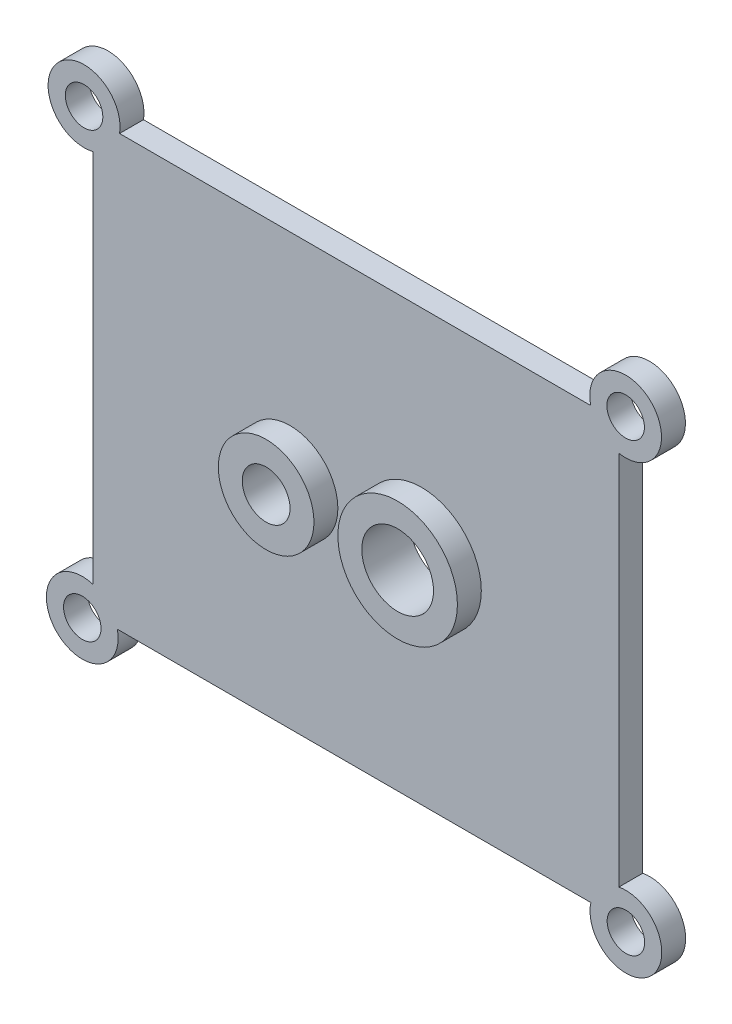
from build123d import *

# Parameters (mm, degrees)
SKETCH1_W           = 69.85
SKETCH1_H           = 57.15
BOSS_EXTRUDE1_DEPTH = 3.175
SKETCH2_R           = 4.776740808
SKETCH2_R_2         = 4.7625
BOSS_EXTRUDE2_DEPTH = 3.175
SKETCH3_R           = 2.4892
CUT_EXTRUDE1_DEPTH  = 54.678109207
SKETCH4_R           = 3.175
SKETCH4_R_2         = 4.7625
CUT_EXTRUDE2_DEPTH  = 54.678109207
SKETCH5_R           = 6.35
SKETCH5_R_2         = 7.9375
BOSS_EXTRUDE3_DEPTH = 3.175
SKETCH6_R           = 4.7625
SKETCH6_R_2         = 3.175
CUT_EXTRUDE3_DEPTH  = 54.959070443


with BuildPart() as part:
    # Sketch1 → Boss-Extrude1 (new body)
    with BuildSketch(Plane.XY):
        Rectangle(SKETCH1_W, SKETCH1_H)
    extrude(amount=BOSS_EXTRUDE1_DEPTH)

    # Sketch2 → Boss-Extrude2 (add)
    with BuildSketch(Plane.XY.offset(3.175)):
        with Locations((-36.080944449, 29.359475258)):
            Circle(SKETCH2_R)
        with Locations((35.832665303, 29.636957013)):
            Circle(SKETCH2_R_2)
        with Locations((35.864779118, -29.608646076)):
            Circle(SKETCH2_R_2)
        with Locations((-36.322, -29.590559194)):
            Circle(SKETCH2_R_2)
    extrude(amount=-BOSS_EXTRUDE2_DEPTH)

    # Sketch3 → Cut-Extrude1 (cut, through all)
    with BuildSketch(Plane.XY.offset(3.175)):
        with Locations((-36.080944449, 29.359475258)):
            Circle(SKETCH3_R)
        with Locations((35.832665303, 29.636957013)):
            Circle(SKETCH3_R)
        with Locations((35.864779118, -29.608646076)):
            Circle(SKETCH3_R)
        with Locations((-36.322, -29.590559194)):
            Circle(SKETCH3_R)
    extrude(amount=-CUT_EXTRUDE1_DEPTH, mode=Mode.SUBTRACT)

    # Sketch4 → Cut-Extrude2 (cut, through all)
    with BuildSketch(Plane.XY.offset(3.175)):
        with Locations((-8.73125, -0.039106259)):
            Circle(SKETCH4_R)
        with Locations((8.73125, 0.002745202)):
            Circle(SKETCH4_R_2)
    extrude(amount=-CUT_EXTRUDE2_DEPTH, mode=Mode.SUBTRACT)

    # Sketch5 → Boss-Extrude3 (add)
    with BuildSketch(Plane.XY.offset(3.175)):
        with Locations((-8.73125, -0.039106259)):
            Circle(SKETCH5_R)
        with Locations((8.73125, 0.002745202)):
            Circle(SKETCH5_R_2)
    extrude(amount=BOSS_EXTRUDE3_DEPTH)

    # Sketch6 → Cut-Extrude3 (cut, through all)
    with BuildSketch(Plane.XY.offset(6.35)):
        with Locations((8.73125, 0.002745202)):
            Circle(SKETCH6_R)
        with Locations((-8.73125, -0.039106259)):
            Circle(SKETCH6_R_2)
    extrude(amount=-CUT_EXTRUDE3_DEPTH, mode=Mode.SUBTRACT)


solid = part.part
